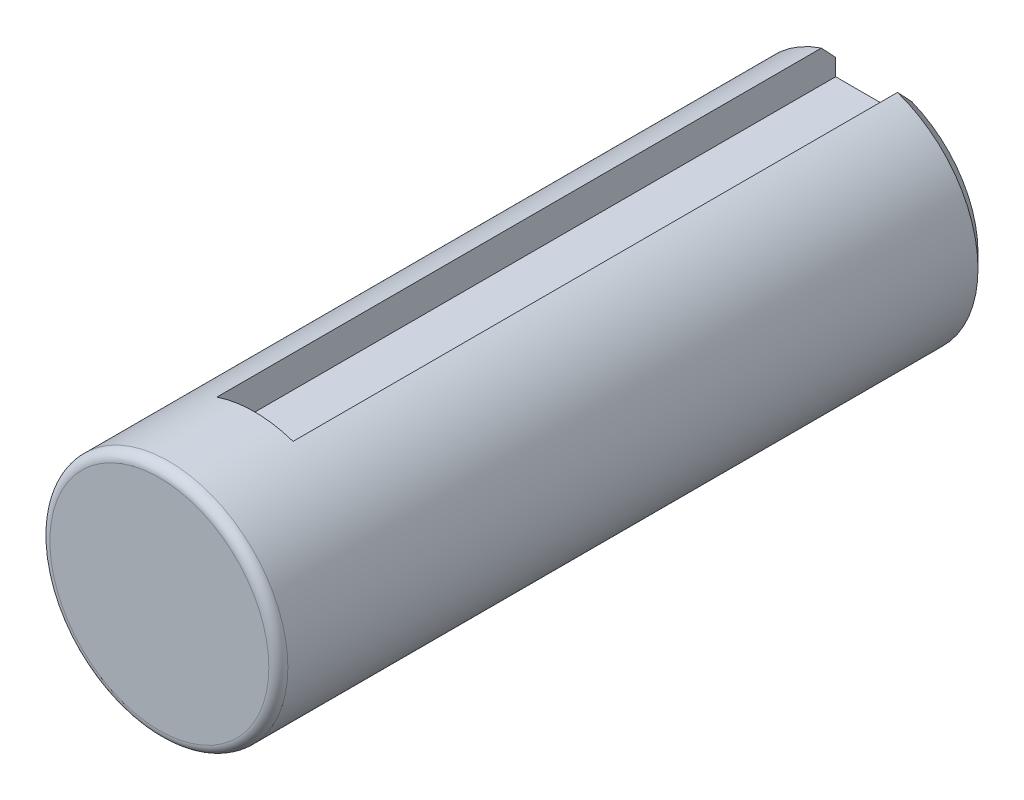
from build123d import *

# Parameters (mm, degrees)
SKETCH1_R           = 12.5
BOSS_EXTRUDE1_DEPTH = 75
CUT_EXTRUDE1_DEPTH  = 65
CHAMFER1_SIZE       = 1.5
FILLET1_R           = 3
FILLET2_R           = 1


with BuildPart() as part:
    # Sketch1 → Boss-Extrude1 (new body)
    with BuildSketch(Plane.XY):
        Circle(SKETCH1_R)
    extrude(amount=BOSS_EXTRUDE1_DEPTH)

    # Sketch2 → Cut-Extrude1 (cut)
    with BuildSketch(Plane(origin=(0, 0, 0), x_dir=(-1, 0, 0), z_dir=(0, 0, -1))):
        with BuildLine():
            Line((-4.045894985, 8.5), (0, 8.5))
            Line((0, 8.5), (0, 12.5))
            ThreePointArc((0, 12.5), (-2.050733749, 12.330632226), (-4.045894985, 11.827118574))
            Line((-4.045894985, 11.827118574), (-4.045894985, 8.5))
        make_face()
        with BuildLine():
            Line((0, 12.5), (0, 8.5))
            Line((0, 8.5), (3.954105015, 8.5))
            Line((3.954105015, 8.5), (3.954105015, 11.858121838))
            ThreePointArc((3.954105015, 11.858121838), (2.002932478, 12.338487002), (0, 12.5))
        make_face()
    extrude(amount=-CUT_EXTRUDE1_DEPTH, mode=Mode.SUBTRACT)

    # Chamfer1
    chamfer1_edges = [part.edges().sort_by_distance(p)[0] for p in [
        (-7.308340691, -10.140914966, 0),
    ]]
    chamfer(chamfer1_edges, length=CHAMFER1_SIZE)

    # Fillet1
    fillet1_edges = [part.edges().sort_by_distance(p)[0] for p in [
        (0.045894985, 8.5, 65),
    ]]
    fillet(fillet1_edges, radius=FILLET1_R)

    # Fillet2
    fillet2_edges = [part.edges().sort_by_distance(p)[0] for p in [
        (-12.5, 0, 75),
    ]]
    fillet(fillet2_edges, radius=FILLET2_R)


solid = part.part
